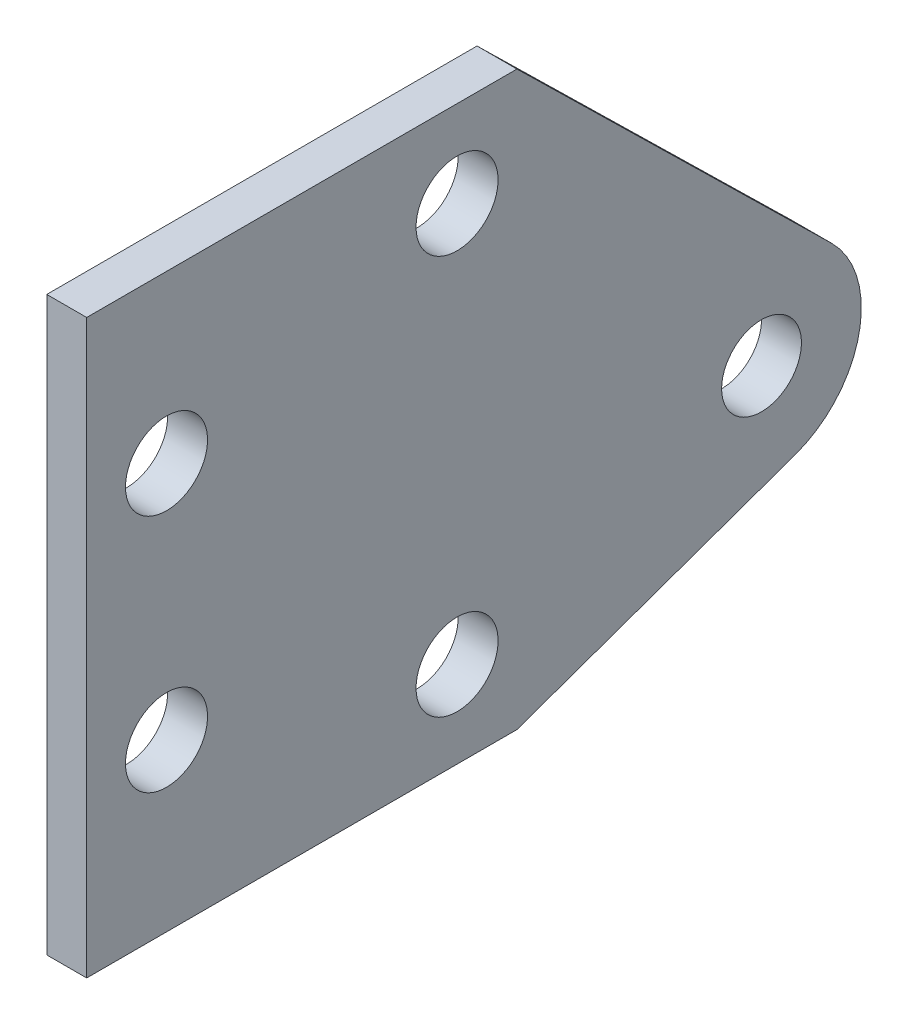
from build123d import *

# Parameters (mm, degrees)
SKETCH1_R           = 3.175
SKETCH1_R_2         = 3.2639
SKETCH1_R_3         = 3.96875
BOSS_EXTRUDE1_DEPTH = 3.175


with BuildPart() as part:
    # Sketch1 → Boss-Extrude1 (new body)
    # profile 1 of 3: a face of its own
    with BuildSketch(Plane.ZY.offset(25.4)):
        with BuildLine():
            Line((-88.4975, 379.360683619), (-113.503995941, 354.868900976))
            ThreePointArc((-113.503995941, 354.868900976), (-115.701762144, 347.491113055), (-110.608164688, 341.71900808))
            Line((-110.608164688, 341.71900808), (-88.4975, 333.860683619))
            Line((-88.4975, 333.860683619), (-102.195874596, 351.845168269))
            ThreePointArc((-102.195874596, 351.845168269), (-103.980307482, 357.263971701), (-102.037425504, 362.628003857))
            Line((-102.037425504, 362.628003857), (-88.4975, 379.360683619))
        make_face()
        with Locations((-107.95, 349.198183619)):
            Circle(SKETCH1_R, mode=Mode.SUBTRACT)
    # profile 2 of 3: a face of its own
    with BuildSketch(Plane.ZY.offset(25.4)):
        with BuildLine():
            Line((-54.275, 333.860683619), (-54.275, 379.360683619))
            Line((-54.275, 379.360683619), (-88.4975, 379.360683619))
            Line((-88.4975, 379.360683619), (-102.037425504, 362.628003857))
            ThreePointArc((-102.037425504, 362.628003857), (-103.980307482, 357.263971701), (-102.195874596, 351.845168269))
            Line((-102.195874596, 351.845168269), (-88.4975, 333.860683619))
            Line((-88.4975, 333.860683619), (-54.275, 333.860683619))
        make_face()
        with Locations((-83.735, 340.735683619)):
            Circle(SKETCH1_R_2, mode=Mode.SUBTRACT)
        with Locations((-95.25, 357.135683619)):
            Circle(SKETCH1_R_3, mode=Mode.SUBTRACT)
        with Locations((-60.625, 366.135683619)):
            Circle(SKETCH1_R_2, mode=Mode.SUBTRACT)
        with Locations((-83.735, 372.485683619)):
            Circle(SKETCH1_R_2, mode=Mode.SUBTRACT)
        with Locations((-60.625, 347.085683619)):
            Circle(SKETCH1_R_2, mode=Mode.SUBTRACT)
    # profile 3 of 3: a face of its own
    with BuildSketch(Plane.ZY.offset(25.4)):
        with Locations((-95.25, 357.135683619)):
            Circle(SKETCH1_R_3)
    extrude(amount=BOSS_EXTRUDE1_DEPTH)


solid = part.part
